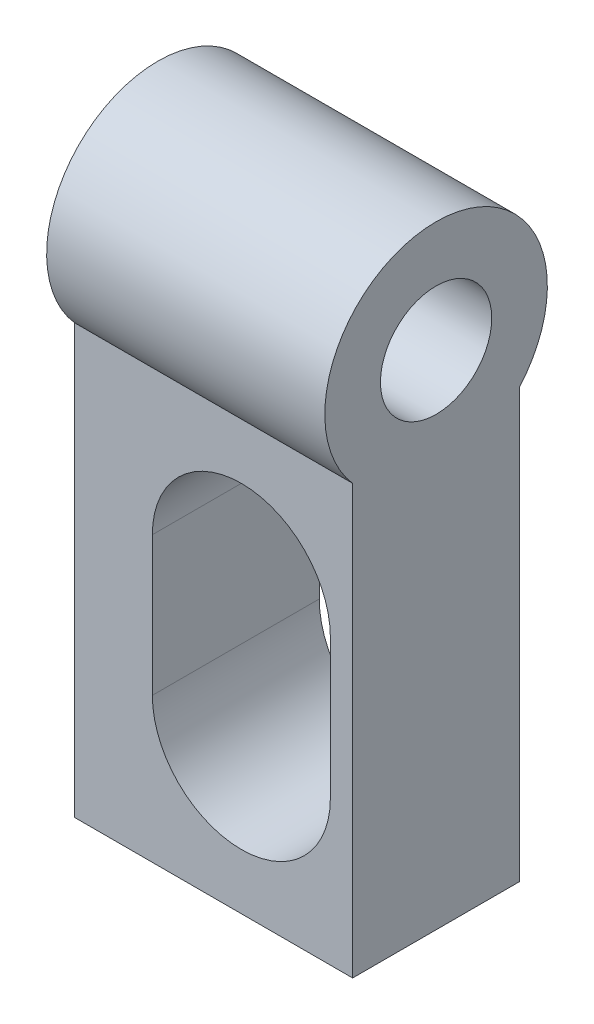
from build123d import *

# Parameters (mm, degrees)
SKETCH1_R           = 1
BOSS_EXTRUDE1_DEPTH = 5
CUT_EXTRUDE1_DEPTH  = 13.599753478
SKETCH3_W           = 7.922403452
SKETCH3_H           = 13.574904792
CUT_EXTRUDE2_DEPTH  = 5


with BuildPart() as part:
    # Sketch1 → Boss-Extrude1 (new body)
    with BuildSketch(Plane(origin=(0, 0, 0), x_dir=(0, 0, -1), z_dir=(1, 0, 0))):
        with BuildLine():
            ThreePointArc((0, 7.7), (1.5, 11.022875656), (3, 7.7))
            Line((3, 7.7), (3, 0))
            Line((3, 0), (0, 0))
            Line((0, 0), (0, 7.7))
        make_face()
        with Locations((1.5, 9.022875656)):
            Circle(SKETCH1_R, mode=Mode.SUBTRACT)
    boss_extrude1 = extrude(amount=BOSS_EXTRUDE1_DEPTH)

    # Sketch2 → Cut-Extrude1 (cut, through all)
    with BuildSketch(Plane(origin=(0, 0, -3), x_dir=(-1, 0, 0), z_dir=(0, 0, -1))):
        with BuildLine():
            Line((-0.4, 5.1), (-0.4, 2.6))
            ThreePointArc((-0.4, 2.6), (-2, 1), (-3.6, 2.6))
            Line((-3.6, 2.6), (-3.6, 5.1))
            ThreePointArc((-3.6, 5.1), (-2, 6.7), (-0.4, 5.1))
        make_face()
    cut_extrude1 = extrude(amount=-CUT_EXTRUDE1_DEPTH, mode=Mode.SUBTRACT)

    # Mirror1: Boss-Extrude1, Cut-Extrude1 across plane
    add(boss_extrude1.mirror(Plane(origin=(5, 0, 0), x_dir=(0, 0, 1), z_dir=(1, 0, 0))))
    add(cut_extrude1.mirror(Plane(origin=(5, 0, 0), x_dir=(0, 0, 1), z_dir=(1, 0, 0))), mode=Mode.SUBTRACT)

    # Sketch3 → Cut-Extrude2 (cut)
    with BuildSketch(Plane.ZY):
        with Locations((-1.410984231, 5.877460577)):
            Rectangle(SKETCH3_W, SKETCH3_H)
    extrude(amount=-CUT_EXTRUDE2_DEPTH, mode=Mode.SUBTRACT)


solid = part.part
